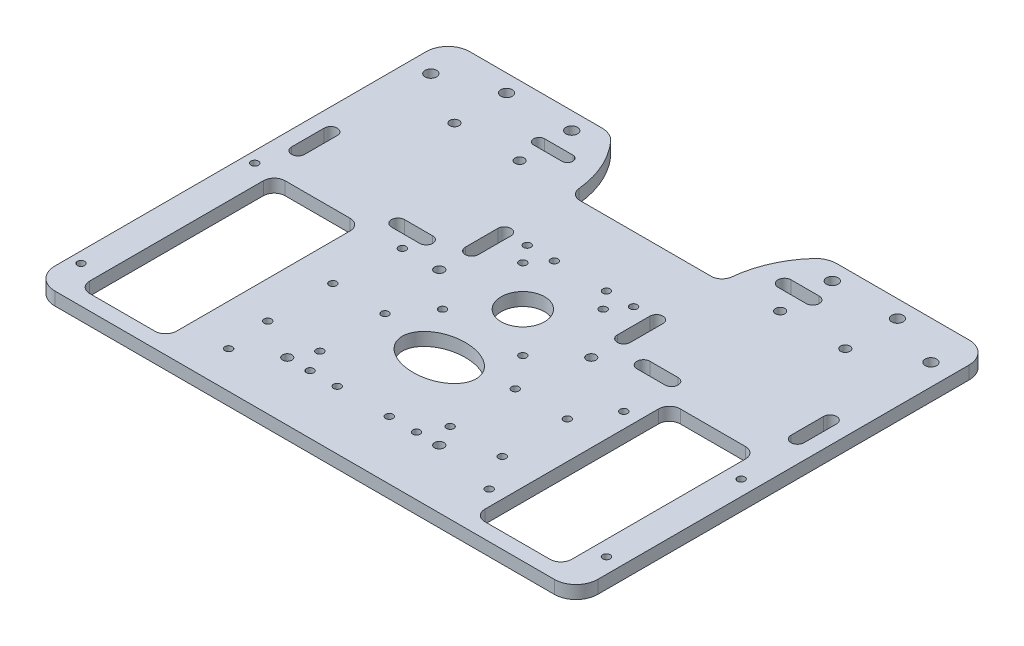
from build123d import *

# Parameters (mm, degrees)
SKETCH_1_R      = 1.7
SKETCH_1_R_2    = 2.15
SKETCH_1_R_3    = 2.65
SKETCH_1_R_4    = 10
EXTRUDE_2_DEPTH = 6


with BuildPart() as part:
    # 草图1 → 凸台-拉伸2 (new body)
    with BuildSketch(Plane(origin=(0, 0, 0), x_dir=(1, 0, 0), z_dir=(0, 1, 0))):
        with BuildLine():
            ThreePointArc((-125, -42), (-122.071067812, -49.071067812), (-115, -52))
            Line((-115, -52), (115, -52))
            ThreePointArc((115, -52), (122.071067812, -49.071067812), (125, -42))
            Line((125, -42), (125, 129))
            ThreePointArc((125, 129), (122.071067812, 136.071067812), (115, 139))
            Line((115, 139), (54.15581278, 139))
            ThreePointArc((54.15581278, 139), (50.06955504, 138.127020198), (46.696741396, 135.660499537))
            ThreePointArc((46.696741396, 135.660499537), (38.879992551, 123.497665763), (35.221472878, 109.510124102))
            ThreePointArc((35.221472878, 109.510124102), (33.603401462, 106.295315162), (30.245528585, 105))
            Line((30.245528585, 105), (-30.245528585, 105))
            ThreePointArc((-30.245528585, 105), (-33.603401462, 106.295315162), (-35.221472878, 109.510124102))
            ThreePointArc((-35.221472878, 109.510124102), (-38.879992551, 123.497665763), (-46.696741396, 135.660499537))
            ThreePointArc((-46.696741396, 135.660499537), (-50.06955504, 138.127020198), (-54.15581278, 139))
            Line((-54.15581278, 139), (-115, 139))
            ThreePointArc((-115, 139), (-122.071067812, 136.071067812), (-125, 129))
            Line((-125, 129), (-125, -42))
        make_face()
        with Locations(Location((-120, -35, 0), (0, 0, 270))):
            Circle(SKETCH_1_R, mode=Mode.SUBTRACT)
        with Locations(Location((-52, -35, 0), (0, 0, 270))):
            Circle(SKETCH_1_R, mode=Mode.SUBTRACT)
        with Locations(Location((-35, -25, 0), (0, 0, 270))):
            Circle(SKETCH_1_R_2, mode=Mode.SUBTRACT)
        with Locations(Location((-24.5, -25, 0), (0, 0, 270))):
            Circle(SKETCH_1_R, mode=Mode.SUBTRACT)
        with Locations(Location((-12, -25, 0), (0, 0, 270))):
            Circle(SKETCH_1_R, mode=Mode.SUBTRACT)
        with Locations(Location((-54, -15, 0), (0, 0, 270))):
            Circle(SKETCH_1_R, mode=Mode.SUBTRACT)
        with Locations(Location((-30, -15, 0), (0, 0, 270))):
            Circle(SKETCH_1_R, mode=Mode.SUBTRACT)
        with BuildLine():
            ThreePointArc((-76, 45), (-72.464466094, 43.535533906), (-71, 40))
            Line((-71, 40), (-71, -40))
            ThreePointArc((-71, -40), (-72.464466094, -43.535533906), (-76, -45))
            Line((-76, -45), (-106, -45))
            ThreePointArc((-106, -45), (-109.535533906, -43.535533906), (-111, -40))
            Line((-111, -40), (-111, 40))
            ThreePointArc((-111, 40), (-109.535533906, 43.535533906), (-106, 45))
            Line((-106, 45), (-76, 45))
        make_face(mode=Mode.SUBTRACT)
        with Locations(Location((-54, 15, 0), (0, 0, 270))):
            Circle(SKETCH_1_R, mode=Mode.SUBTRACT)
        with Locations(Location((-30, 15, 0), (0, 0, 270))):
            Circle(SKETCH_1_R, mode=Mode.SUBTRACT)
        with Locations(Location((-18.5, 30, 0), (0, 0, 270))):
            Circle(SKETCH_1_R, mode=Mode.SUBTRACT)
        with Locations(Location((12, -25, 0), (0, 0, 270))):
            Circle(SKETCH_1_R, mode=Mode.SUBTRACT)
        with Locations(Location((24.5, -25, 0), (0, 0, 270))):
            Circle(SKETCH_1_R, mode=Mode.SUBTRACT)
        with Locations(Location((35, -25, 0), (0, 0, 270))):
            Circle(SKETCH_1_R_2, mode=Mode.SUBTRACT)
        with Locations(Location((30, -15, 0), (0, 0, 270))):
            Circle(SKETCH_1_R, mode=Mode.SUBTRACT)
        with Locations(Location((54, -15, 0), (0, 0, 270))):
            Circle(SKETCH_1_R, mode=Mode.SUBTRACT)
        with Locations(Location((64, -31, 0), (0, 0, 270))):
            Circle(SKETCH_1_R, mode=Mode.SUBTRACT)
        with Locations(Location((118, -31, 0), (0, 0, 270))):
            Circle(SKETCH_1_R, mode=Mode.SUBTRACT)
        with BuildLine():
            add(Edge.make_bspline(
                [(-17, 10), (-17, -10.784609691), (8.5, -0.392304845), (34, 10), (8.5, 20.392304845), (-17, 30.784609691), (-17, 10)],
                knots=[0, 0, 0, 2.094395102, 2.094395102, 4.188790205, 4.188790205, 6.283185307, 6.283185307, 6.283185307], degree=2, weights=[1, 0.5, 1, 0.5, 1, 0.5, 1]))
        make_face(mode=Mode.SUBTRACT)
        with Locations(Location((30, 15, 0), (0, 0, 270))):
            Circle(SKETCH_1_R, mode=Mode.SUBTRACT)
        with Locations(Location((54, 15, 0), (0, 0, 270))):
            Circle(SKETCH_1_R, mode=Mode.SUBTRACT)
        with Locations(Location((18.5, 30, 0), (0, 0, 270))):
            Circle(SKETCH_1_R, mode=Mode.SUBTRACT)
        with BuildLine():
            ThreePointArc((76, -45), (72.464466094, -43.535533906), (71, -40))
            Line((71, -40), (71, 40))
            ThreePointArc((71, 40), (72.464466094, 43.535533906), (76, 45))
            Line((76, 45), (106, 45))
            ThreePointArc((106, 45), (109.535533906, 43.535533906), (111, 40))
            Line((111, 40), (111, -40))
            ThreePointArc((111, -40), (109.535533906, -43.535533906), (106, -45))
            Line((106, -45), (76, -45))
        make_face(mode=Mode.SUBTRACT)
        with Locations(Location((64, 31, 0), (0, 0, 270))):
            Circle(SKETCH_1_R, mode=Mode.SUBTRACT)
        with Locations(Location((118, 31, 0), (0, 0, 270))):
            Circle(SKETCH_1_R, mode=Mode.SUBTRACT)
        with Locations(Location((-120, 45, 0), (0, 0, 270))):
            Circle(SKETCH_1_R, mode=Mode.SUBTRACT)
        with BuildLine():
            ThreePointArc((-118, 75), (-115, 78), (-112, 75))
            Line((-112, 75), (-112, 60))
            ThreePointArc((-112, 60), (-115, 57), (-118, 60))
            Line((-118, 60), (-118, 75))
        make_face(mode=Mode.SUBTRACT)
        with Locations(Location((-52, 45, 0), (0, 0, 270))):
            Circle(SKETCH_1_R, mode=Mode.SUBTRACT)
        with BuildLine():
            ThreePointArc((-63, 51), (-66, 54), (-63, 57))
            Line((-63, 57), (-50, 57))
            ThreePointArc((-50, 57), (-47, 54), (-50, 51))
            Line((-50, 51), (-63, 51))
        make_face(mode=Mode.SUBTRACT)
        with Locations(Location((-35, 45, 0), (0, 0, 270))):
            Circle(SKETCH_1_R_2, mode=Mode.SUBTRACT)
        with BuildLine():
            ThreePointArc((-32, 60), (-35, 57), (-38, 60))
            Line((-38, 60), (-38, 75))
            ThreePointArc((-38, 75), (-35, 78), (-32, 75))
            Line((-32, 75), (-32, 60))
        make_face(mode=Mode.SUBTRACT)
        with Locations(Location((-18.5, 67, 0), (0, 0, 270))):
            Circle(SKETCH_1_R, mode=Mode.SUBTRACT)
        with Locations(Location((-24.5, 75, 0), (0, 0, 270))):
            Circle(SKETCH_1_R, mode=Mode.SUBTRACT)
        with BuildLine():
            ThreePointArc((-10.3, 75), (-12, 73.3), (-13.7, 75))
            ThreePointArc((-13.7, 75), (-12, 76.7), (-10.3, 75))
        make_face(mode=Mode.SUBTRACT)
        with Locations(Location((-115.149234169, 121.275702051, 0), (0, 0, 270))):
            Circle(SKETCH_1_R_3, mode=Mode.SUBTRACT)
        with Locations(Location((-90, 131, 0), (0, 0, 270))):
            Circle(SKETCH_1_R_3, mode=Mode.SUBTRACT)
        with Locations(Location((-60, 131, 0), (0, 0, 270))):
            Circle(SKETCH_1_R_3, mode=Mode.SUBTRACT)
        with Locations(Location((-90, 107, 0), (0, 0, 270))):
            Circle(SKETCH_1_R_2, mode=Mode.SUBTRACT)
        with BuildLine():
            ThreePointArc((-50, 121.5), (-47.5, 119), (-50, 116.5))
            Line((-50, 116.5), (-63, 116.5))
            ThreePointArc((-63, 116.5), (-65.5, 119), (-63, 121.5))
            Line((-63, 121.5), (-50, 121.5))
        make_face(mode=Mode.SUBTRACT)
        with Locations(Location((-60, 107, 0), (0, 0, 270))):
            Circle(SKETCH_1_R_2, mode=Mode.SUBTRACT)
        with Locations(Location((0, 48.5, 0), (0, 0, 270))):
            Circle(SKETCH_1_R_4, mode=Mode.SUBTRACT)
        with Locations(Location((35, 45, 0), (0, 0, 270))):
            Circle(SKETCH_1_R_2, mode=Mode.SUBTRACT)
        with BuildLine():
            ThreePointArc((50, 51), (47, 54), (50, 57))
            Line((50, 57), (63, 57))
            ThreePointArc((63, 57), (66, 54), (63, 51))
            Line((63, 51), (50, 51))
        make_face(mode=Mode.SUBTRACT)
        with Locations(Location((12, 75, 0), (0, 0, 270))):
            Circle(SKETCH_1_R, mode=Mode.SUBTRACT)
        with Locations(Location((18.5, 67, 0), (0, 0, 270))):
            Circle(SKETCH_1_R, mode=Mode.SUBTRACT)
        with Locations(Location((24.5, 75, 0), (0, 0, 270))):
            Circle(SKETCH_1_R, mode=Mode.SUBTRACT)
        with BuildLine():
            Line((38, 75), (38, 60))
            ThreePointArc((38, 60), (35, 57), (32, 60))
            Line((32, 60), (32, 75))
            ThreePointArc((32, 75), (35, 78), (38, 75))
        make_face(mode=Mode.SUBTRACT)
        with BuildLine():
            Line((118, 75), (118, 60))
            ThreePointArc((118, 60), (115, 57), (112, 60))
            Line((112, 60), (112, 75))
            ThreePointArc((112, 75), (115, 78), (118, 75))
        make_face(mode=Mode.SUBTRACT)
        with BuildLine():
            ThreePointArc((63, 122), (66, 119), (63, 116))
            Line((63, 116), (50, 116))
            ThreePointArc((50, 116), (47, 119), (50, 122))
            Line((50, 122), (63, 122))
        make_face(mode=Mode.SUBTRACT)
        with Locations(Location((60, 107, 0), (0, 0, 270))):
            Circle(SKETCH_1_R_2, mode=Mode.SUBTRACT)
        with Locations(Location((90, 107, 0), (0, 0, 270))):
            Circle(SKETCH_1_R_2, mode=Mode.SUBTRACT)
        with Locations(Location((60, 131, 0), (0, 0, 270))):
            Circle(SKETCH_1_R_3, mode=Mode.SUBTRACT)
        with Locations(Location((115.149234169, 121.275702051, 0), (0, 0, 270))):
            Circle(SKETCH_1_R_3, mode=Mode.SUBTRACT)
        with Locations(Location((90, 131, 0), (0, 0, 270))):
            Circle(SKETCH_1_R_3, mode=Mode.SUBTRACT)
    extrude(amount=EXTRUDE_2_DEPTH)


solid = part.part
